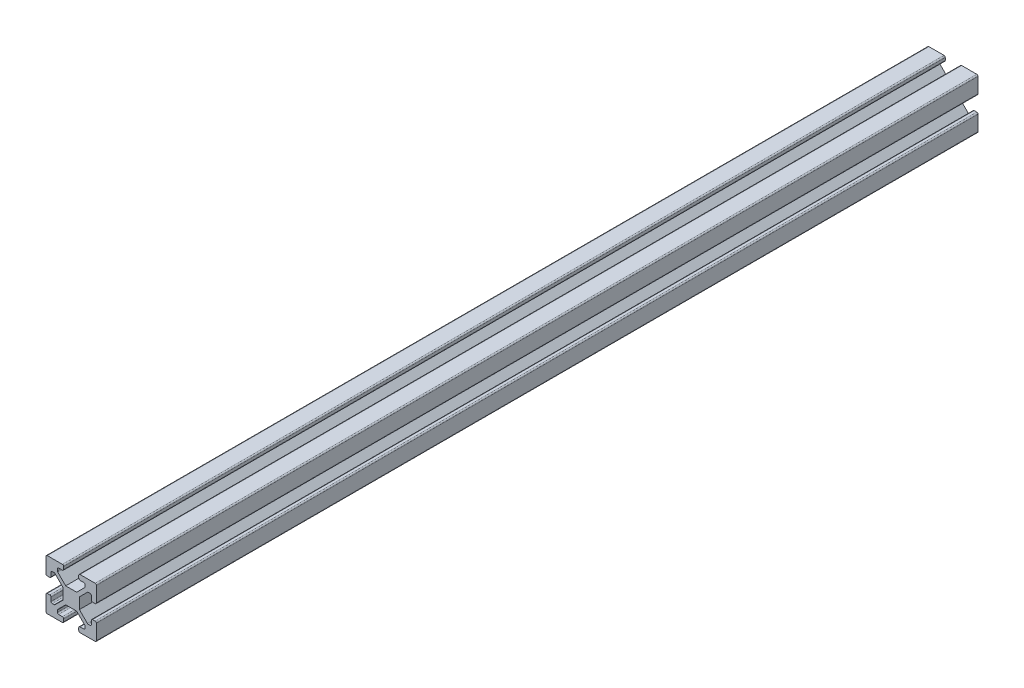
from build123d import *

# Parameters (mm, degrees)
EXTRUDE_1_DEPTH = 350


with BuildPart() as part:
    # 草图1 → 凸台-拉伸1 (new body)
    with BuildSketch(Plane.XY):
        with BuildLine():
            Line((6.5, 0), (0.5, 0))
            ThreePointArc((0.5, 0), (0.146446609, -0.146446609), (0, -0.5))
            Line((0, -0.5), (0, -6.5))
            ThreePointArc((0, -6.5), (0.146446609, -6.853553391), (0.5, -7))
            Line((0.5, -7), (1.5, -7))
            ThreePointArc((1.5, -7), (1.853553391, -6.853553391), (2, -6.5))
            Line((2, -6.5), (2, -5))
            ThreePointArc((2, -5), (2.146446609, -4.646446609), (2.5, -4.5))
            Line((2.5, -4.5), (3.220918534, -4.5))
            ThreePointArc((3.220918534, -4.5), (3.412260251, -4.538060234), (3.574471925, -4.646446609))
            Line((3.574471925, -4.646446609), (6.741642787, -7.813617472))
            Line((6.741642787, -7.813617472), (6.741642787, -12.186382528))
            Line((6.741642787, -12.186382528), (3.574471925, -15.353553391))
            ThreePointArc((3.574471925, -15.353553391), (3.412260251, -15.461939766), (3.220918534, -15.5))
            Line((3.220918534, -15.5), (2.5, -15.5))
            ThreePointArc((2.5, -15.5), (2.146446609, -15.353553391), (2, -15))
            Line((2, -15), (2, -13.5))
            ThreePointArc((2, -13.5), (1.853553391, -13.146446609), (1.5, -13))
            Line((1.5, -13), (0.5, -13))
            ThreePointArc((0.5, -13), (0.146446609, -13.146446609), (0, -13.5))
            Line((0, -13.5), (0, -19.5))
            ThreePointArc((0, -19.5), (0.146446609, -19.853553391), (0.5, -20))
            Line((0.5, -20), (6.5, -20))
            ThreePointArc((6.5, -20), (6.853553391, -19.853553391), (7, -19.5))
            Line((7, -19.5), (7, -18.5))
            ThreePointArc((7, -18.5), (6.853553391, -18.146446609), (6.5, -18))
            Line((6.5, -18), (5, -18))
            ThreePointArc((5, -18), (4.646446609, -17.853553391), (4.5, -17.5))
            Line((4.5, -17.5), (4.5, -16.779081466))
            ThreePointArc((4.5, -16.779081466), (4.538060234, -16.587739749), (4.646446609, -16.425528075))
            Line((4.646446609, -16.425528075), (7.667170862, -13.404803822))
            ThreePointArc((7.667170862, -13.404803822), (7.829382537, -13.296417446), (8.020724253, -13.258357213))
            Line((8.020724253, -13.258357213), (11.979275747, -13.258357213))
            ThreePointArc((11.979275747, -13.258357213), (12.170617463, -13.296417446), (12.332829138, -13.404803822))
            Line((12.332829138, -13.404803822), (15.353553391, -16.425528075))
            ThreePointArc((15.353553391, -16.425528075), (15.461939766, -16.587739749), (15.5, -16.779081466))
            Line((15.5, -16.779081466), (15.5, -17.5))
            ThreePointArc((15.5, -17.5), (15.353553391, -17.853553391), (15, -18))
            Line((15, -18), (13.5, -18))
            ThreePointArc((13.5, -18), (13.146446609, -18.146446609), (13, -18.5))
            Line((13, -18.5), (13, -19.5))
            ThreePointArc((13, -19.5), (13.146446609, -19.853553391), (13.5, -20))
            Line((13.5, -20), (19.5, -20))
            ThreePointArc((19.5, -20), (19.853553391, -19.853553391), (20, -19.5))
            Line((20, -19.5), (20, -13.5))
            ThreePointArc((20, -13.5), (19.853553391, -13.146446609), (19.5, -13))
            Line((19.5, -13), (18.5, -13))
            ThreePointArc((18.5, -13), (18.146446609, -13.146446609), (18, -13.5))
            Line((18, -13.5), (18, -15))
            ThreePointArc((18, -15), (17.853553391, -15.353553391), (17.5, -15.5))
            Line((17.5, -15.5), (16.779081466, -15.5))
            ThreePointArc((16.779081466, -15.5), (16.587739749, -15.461939766), (16.425528075, -15.353553391))
            Line((16.425528075, -15.353553391), (13.258357213, -12.186382528))
            Line((13.258357213, -12.186382528), (13.258357213, -7.813617472))
            Line((13.258357213, -7.813617472), (16.425528075, -4.646446609))
            ThreePointArc((16.425528075, -4.646446609), (16.587739749, -4.538060234), (16.779081466, -4.5))
            Line((16.779081466, -4.5), (17.5, -4.5))
            ThreePointArc((17.5, -4.5), (17.853553391, -4.646446609), (18, -5))
            Line((18, -5), (18, -6.5))
            ThreePointArc((18, -6.5), (18.146446609, -6.853553391), (18.5, -7))
            Line((18.5, -7), (19.5, -7))
            ThreePointArc((19.5, -7), (19.853553391, -6.853553391), (20, -6.5))
            Line((20, -6.5), (20, -0.5))
            ThreePointArc((20, -0.5), (19.853553391, -0.146446609), (19.5, 0))
            Line((19.5, 0), (13.5, 0))
            ThreePointArc((13.5, 0), (13.146446609, -0.146446609), (13, -0.5))
            Line((13, -0.5), (13, -1.5))
            ThreePointArc((13, -1.5), (13.146446609, -1.853553391), (13.5, -2))
            Line((13.5, -2), (15, -2))
            ThreePointArc((15, -2), (15.353553391, -2.146446609), (15.5, -2.5))
            Line((15.5, -2.5), (15.5, -3.220918534))
            ThreePointArc((15.5, -3.220918534), (15.461939766, -3.412260251), (15.353553391, -3.574471925))
            Line((15.353553391, -3.574471925), (12.186382528, -6.741642787))
            Line((12.186382528, -6.741642787), (7.813617472, -6.741642787))
            Line((7.813617472, -6.741642787), (4.646446609, -3.574471925))
            ThreePointArc((4.646446609, -3.574471925), (4.538060234, -3.412260251), (4.5, -3.220918534))
            Line((4.5, -3.220918534), (4.5, -2.5))
            ThreePointArc((4.5, -2.5), (4.646446609, -2.146446609), (5, -2))
            Line((5, -2), (6.5, -2))
            ThreePointArc((6.5, -2), (6.853553391, -1.853553391), (7, -1.5))
            Line((7, -1.5), (7, -0.5))
            ThreePointArc((7, -0.5), (6.853553391, -0.146446609), (6.5, 0))
        make_face()
    extrude(amount=EXTRUDE_1_DEPTH)


solid = part.part
